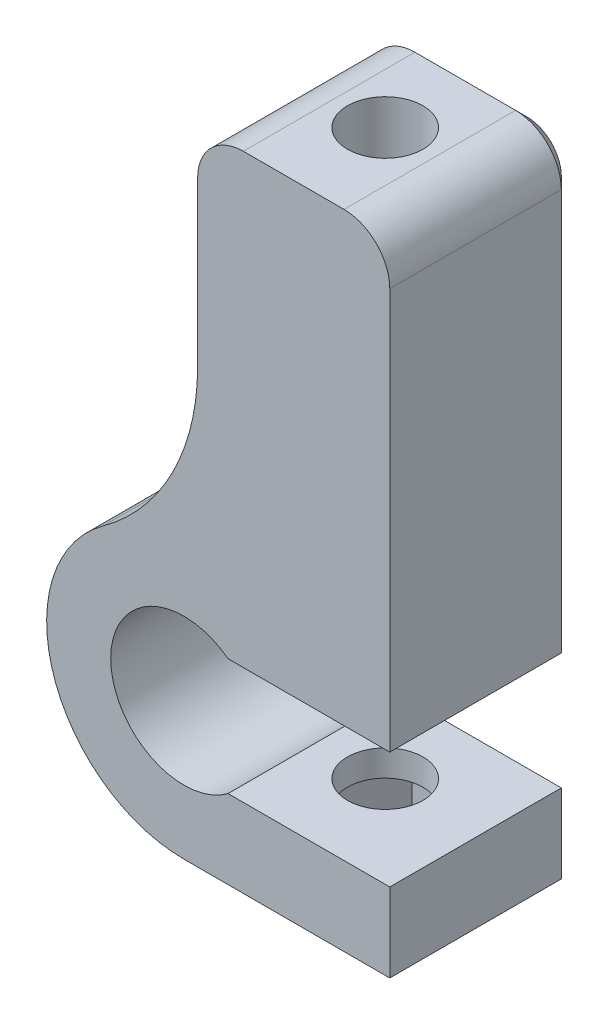
from build123d import *

# Parameters (mm, degrees)
BOSS_EXTRUDE1_DEPTH = 8
SKETCH2_R           = 1.65
CUT_EXTRUDE1_DEPTH  = 18
CUT_EXTRUDE2_DEPTH  = 2.3
SKETCH5_W           = 8.4
SKETCH5_H           = 8
SKETCH5_R           = 1.65
BOSS_EXTRUDE2_DEPTH = 16.1
FILLET1_R           = 10
FILLET2_R           = 2
CHAMFER1_SIZE       = 0.5


with BuildPart() as part:
    # Sketch1 → Boss-Extrude1 (new body)
    with BuildSketch(Plane.XY):
        with BuildLine():
            Line((0, 6), (9, 6))
            Line((9, 6), (9, 2.552710574))
            Line((9, 2.552710574), (1.929680991, 2.552710574))
            ThreePointArc((1.929680991, 2.552710574), (-3.2, 0), (1.929680991, -2.552710574))
            Line((1.929680991, -2.552710574), (9, -2.552710574))
            Line((9, -2.552710574), (9, -6))
            Line((9, -6), (0, -6))
            ThreePointArc((0, -6), (-6, 0), (0, 6))
        make_face()
    extrude(amount=BOSS_EXTRUDE1_DEPTH)

    # Sketch2 → Cut-Extrude1 (cut, through all)
    with BuildSketch(Plane.XZ.offset(6)):
        with Locations(Location((4.8, 4, 0), (0, 0, 270))):
            Circle(SKETCH2_R)
    extrude(amount=-CUT_EXTRUDE1_DEPTH, mode=Mode.SUBTRACT)

    # Sketch3 → Cut-Extrude2 (cut)
    with BuildSketch(Plane.XZ.offset(6)):
        Polygon((6.4, 6.771281292), (3.2, 6.771281292), (1.6, 4), (3.2, 1.228718708), (6.4, 1.228718708), (8, 4), align=None)
    extrude(amount=-CUT_EXTRUDE2_DEPTH, mode=Mode.SUBTRACT)

    # Sketch5 → Boss-Extrude2 (add)
    with BuildSketch(Plane(origin=(0, 6, 0), x_dir=(1, 0, 0), z_dir=(0, 1, 0))):
        with Locations((4.8, -4)):
            Rectangle(SKETCH5_W, SKETCH5_H)
        with Locations(Location((4.8, -4, 0), (0, 0, 90))):
            Circle(SKETCH5_R, mode=Mode.SUBTRACT)
    extrude(amount=BOSS_EXTRUDE2_DEPTH)

    # Fillet1
    fillet1_edges = [part.edges().sort_by_distance(p)[0] for p in [
        (0.6, 6, 4),
    ]]
    fillet(fillet1_edges, radius=FILLET1_R)

    # Fillet2
    fillet2_edges = [part.edges().sort_by_distance(p)[0] for p in [
        (9, 22.1, 4),
        (0.6, 22.1, 4),
    ]]
    fillet(fillet2_edges, radius=FILLET2_R)

    # Chamfer1
    chamfer1_edges = [part.edges().sort_by_distance(p)[0] for p in [
        (5.464840496, 2.552710574, 0),
        (-3.2, 0, 0),
        (-5.706665837, -1.853096064, 0),
        (-0.490735159, 8.406111117, 0),
        (4.8, 22.1, 0),
        (5.464840496, -2.552710574, 0),
        (0.6, 16.523793324, 0),
        (1.185786438, 21.514213562, 0),
        (8.414213562, 21.514213562, 0),
        (9, -4.276355287, 0),
        (4.5, -6, 0),
        (9, 11.326355287, 0),
    ]]
    chamfer(chamfer1_edges, length=CHAMFER1_SIZE)


solid = part.part
